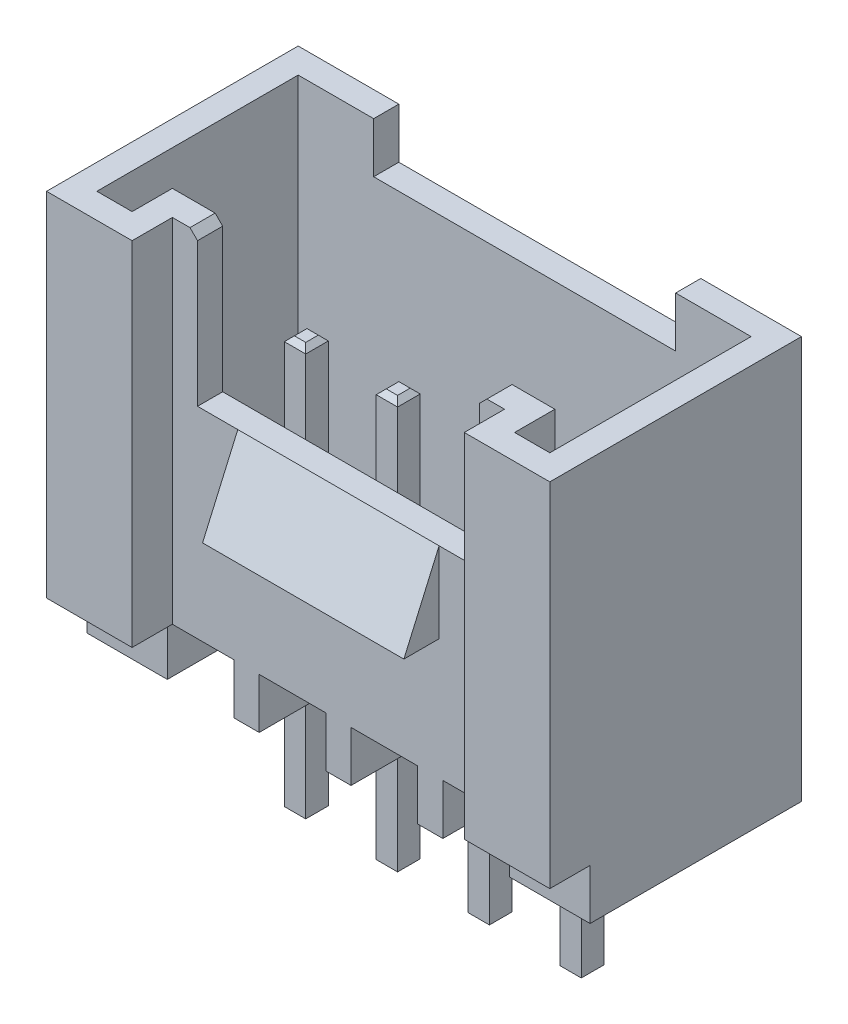
from build123d import *

# Parameters (mm, degrees)
ESQUISSE1_W             = 10
ESQUISSE1_H             = 5
BOSS_EXTRU_1_DEPTH      = 8
ESQUISSE2_W             = 6.6
ESQUISSE2_H             = 0.8
ENL_V_MAT_EXTRU_1_DEPTH = 8
ENL_V_MAT_EXTRU_2_DEPTH = 6.5
ESQUISSE5_W             = 6
ESQUISSE5_H             = 0.5
ENL_V_MAT_EXTRU_3_DEPTH = 1
ESQUISSE6_W             = 5.6
ESQUISSE6_H             = 0.5
ENL_V_MAT_EXTRU_4_DEPTH = 3
ESQUISSE7_W             = 0.8
ESQUISSE7_H             = 1
ENL_V_MAT_EXTRU_5_DEPTH = 10
ESQUISSE8_W             = 6.8
ESQUISSE8_H             = 4.2
ENL_V_MAT_EXTRU_6_DEPTH = 1
BOSS_EXTRU_2_DEPTH      = 6.8
BOSS_EXTRU_3_DEPTH      = 2
BOSS_EXTRU_3_DEPTH_BACK = 2
ESQUISSE12_W            = 0.5
ESQUISSE12_H            = 4.2
BOSS_EXTRU_4_DEPTH      = 1
CHANFREIN1_SIZE         = 0.15
BOSS_EXTRU_5_DEPTH      = 3.2
BOSS_EXTRU_5_DEPTH_BACK = 5
ESQUISSE13_W            = 0.425
ESQUISSE13_H            = 0.45
CHANFREIN2_SIZE         = 0.1


with BuildPart() as part:
    # Esquisse1 → Boss.-Extru.1 (new body)
    with BuildSketch(Plane(origin=(0, 0, 0), x_dir=(1, 0, 0), z_dir=(0, 1, 0))):
        with Locations((5, 2.5)):
            Rectangle(ESQUISSE1_W, ESQUISSE1_H)
    extrude(amount=BOSS_EXTRU_1_DEPTH)

    # Esquisse2 → Enlèv. mat.-Extru.1 (cut)
    with BuildSketch(Plane(origin=(0, 8, 0), x_dir=(1, 0, 0), z_dir=(0, 1, 0))):
        with Locations((5, 0.4)):
            Rectangle(ESQUISSE2_W, ESQUISSE2_H)
    extrude(amount=-ENL_V_MAT_EXTRU_1_DEPTH, mode=Mode.SUBTRACT)

    # Esquisse4 → Enlèv. mat.-Extru.2 (cut)
    with BuildSketch(Plane(origin=(0, 8, 0), x_dir=(1, 0, 0), z_dir=(0, 1, 0))):
        Polygon((0.5, 0.5), (1.2, 0.5), (1.2, 1.3), (8.8, 1.3), (8.8, 0.5), (9.5, 0.5), (9.5, 4.5), (0.5, 4.5), align=None)
    extrude(amount=-ENL_V_MAT_EXTRU_2_DEPTH, mode=Mode.SUBTRACT)

    # Esquisse5 → Enlèv. mat.-Extru.3 (cut)
    with BuildSketch(Plane(origin=(0, 8, 0), x_dir=(1, 0, 0), z_dir=(0, 1, 0))):
        with Locations((5, 4.75)):
            Rectangle(ESQUISSE5_W, ESQUISSE5_H)
    extrude(amount=-ENL_V_MAT_EXTRU_3_DEPTH, mode=Mode.SUBTRACT)

    # Esquisse6 → Enlèv. mat.-Extru.4 (cut)
    with BuildSketch(Plane(origin=(0, 8, 0), x_dir=(1, 0, 0), z_dir=(0, 1, 0))):
        with Locations((5, 1.05)):
            Rectangle(ESQUISSE6_W, ESQUISSE6_H)
    extrude(amount=-ENL_V_MAT_EXTRU_4_DEPTH, mode=Mode.SUBTRACT)

    # Esquisse7 → Enlèv. mat.-Extru.5 (cut)
    with BuildSketch(Plane(origin=(10, 0, 0), x_dir=(0, 0, -1), z_dir=(1, 0, 0))):
        with Locations((0.4, 0.5)):
            Rectangle(ESQUISSE7_W, ESQUISSE7_H)
    extrude(amount=-ENL_V_MAT_EXTRU_5_DEPTH, mode=Mode.SUBTRACT)

    # Esquisse8 → Enlèv. mat.-Extru.6 (cut)
    with BuildSketch(Plane.XZ):
        with Locations((5, -2.9)):
            Rectangle(ESQUISSE8_W, ESQUISSE8_H)
    extrude(amount=-ENL_V_MAT_EXTRU_6_DEPTH, mode=Mode.SUBTRACT)

    # Esquisse9 → Boss.-Extru.2 (add)
    with BuildSketch(Plane(origin=(1.6, 0, 0), x_dir=(0, 0, -1), z_dir=(1, 0, 0))):
        Polygon((4.7, 1), (3.9, 0.2), (1.9, 0.2), (1.1, 1), align=None)
    extrude(amount=BOSS_EXTRU_2_DEPTH)

    # Esquisse11 → Boss.-Extru.3 (add, two sides: drawn at the far end of the back side and taken through both)
    with BuildSketch(Plane(origin=(5, 0, 0), x_dir=(0, 0, -1), z_dir=(1, 0, 0)).offset(-BOSS_EXTRU_3_DEPTH_BACK)):
        Polygon((0.8, 5), (0.1, 3.4), (0.8, 3.4), align=None)
    extrude(amount=BOSS_EXTRU_3_DEPTH + BOSS_EXTRU_3_DEPTH_BACK)

    # Esquisse12 → Boss.-Extru.4 (add)
    with BuildSketch(Plane(origin=(0, 1, 0), x_dir=(1, 0, 0), z_dir=(0, 1, 0))):
        with Locations((5, 2.9)):
            Rectangle(ESQUISSE12_W, ESQUISSE12_H)
        with Locations((3.175, 2.9)):
            Rectangle(ESQUISSE12_W, ESQUISSE12_H)
        with Locations((6.825, 2.9)):
            Rectangle(ESQUISSE12_W, ESQUISSE12_H)
    extrude(amount=-BOSS_EXTRU_4_DEPTH)

    # Chanfrein1
    chanfrein1_edges = [part.edges().sort_by_distance(p)[0] for p in [
        (2.2, 8, -1.05),
        (7.8, 8, -1.05),
    ]]
    chamfer(chanfrein1_edges, length=CHANFREIN1_SIZE)

    # Esquisse13 → Boss.-Extru.5 (add, two sides: drawn at the far end of the back side and taken through both)
    with BuildSketch(Plane.XZ.offset(-0.2).offset(-BOSS_EXTRU_5_DEPTH_BACK)):
        with Locations((2.2625, -2.9)):
            Rectangle(ESQUISSE13_W, ESQUISSE13_H)
        with Locations((4.0875, -2.9)):
            Rectangle(ESQUISSE13_W, ESQUISSE13_H)
        with Locations((5.9125, -2.9)):
            Rectangle(ESQUISSE13_W, ESQUISSE13_H)
        with Locations((7.7375, -2.9)):
            Rectangle(ESQUISSE13_W, ESQUISSE13_H)
    extrude(amount=BOSS_EXTRU_5_DEPTH + BOSS_EXTRU_5_DEPTH_BACK)

    # Chanfrein2
    chanfrein2_edges = [part.edges().sort_by_distance(p)[0] for p in [
        (2.05, 5.2, -2.9),
        (2.2625, 5.2, -2.675),
        (2.475, 5.2, -2.9),
        (2.2625, 5.2, -3.125),
        (2.05, -3, -2.9),
        (2.2625, -3, -3.125),
        (2.475, -3, -2.9),
        (2.2625, -3, -2.675),
        (4.3, 5.2, -2.9),
        (4.0875, 5.2, -3.125),
        (3.875, 5.2, -2.9),
        (4.0875, 5.2, -2.675),
        (4.3, -3, -2.9),
        (4.0875, -3, -2.675),
        (3.875, -3, -2.9),
        (4.0875, -3, -3.125),
        (5.7, 5.2, -2.9),
        (5.9125, 5.2, -2.675),
        (6.125, 5.2, -2.9),
        (5.9125, 5.2, -3.125),
        (5.7, -3, -2.9),
        (5.9125, -3, -3.125),
        (6.125, -3, -2.9),
        (5.9125, -3, -2.675),
        (7.7375, 5.2, -2.675),
        (7.95, 5.2, -2.9),
        (7.7375, 5.2, -3.125),
        (7.525, 5.2, -2.9),
        (7.7375, -3, -2.675),
        (7.525, -3, -2.9),
        (7.7375, -3, -3.125),
        (7.95, -3, -2.9),
    ]]
    chamfer(chanfrein2_edges, length=CHANFREIN2_SIZE)


solid = part.part
